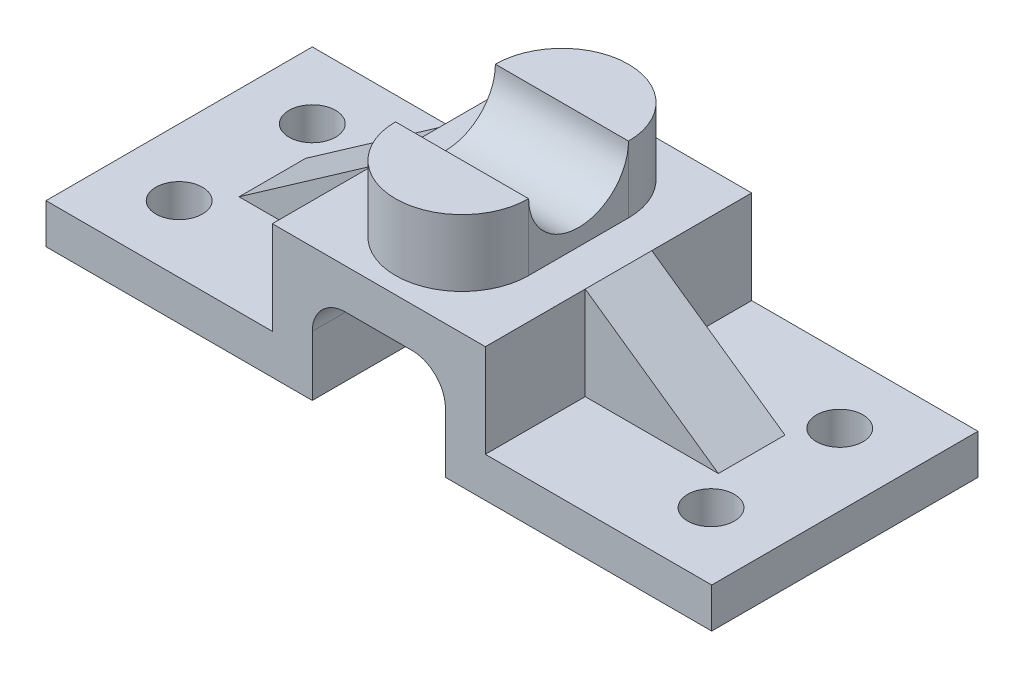
from build123d import *

# Parameters (mm, degrees)
SKETCH1_W           = 100
SKETCH1_H           = 40
SKETCH1_R           = 3.5
BOSS_EXTRUDE1_DEPTH = 6
SKETCH2_W           = 32
SKETCH2_H           = 40
BOSS_EXTRUDE2_DEPTH = 14
SKETCH3_W           = 20
SKETCH3_H           = 40
CUT_EXTRUDE1_DEPTH  = 14
FILLET2_R           = 5
FILLET3_R           = 5
BOSS_EXTRUDE3_DEPTH = 10
BOSS_EXTRUDE4_DEPTH = 10
SKETCH8_R           = 7.5
CUT_EXTRUDE2_DEPTH  = 29


with BuildPart() as part:
    # Sketch1 → Boss-Extrude1 (new body)
    with BuildSketch(Plane(origin=(0, 0, 0), x_dir=(1, 0, 0), z_dir=(0, 1, 0))):
        with Locations((-26.320522258, -4.639903709)):
            Rectangle(SKETCH1_W, SKETCH1_H)
        with Locations(Location((-66.320522258, 5.360096291, 0), (0, 0, 270))):
            Circle(SKETCH1_R, mode=Mode.SUBTRACT)
        with Locations(Location((-66.320522258, -14.639903709, 0), (0, 0, 270))):
            Circle(SKETCH1_R, mode=Mode.SUBTRACT)
        with Locations(Location((12.912927844, 5.360096291, 0), (0, 0, 270))):
            Circle(SKETCH1_R, mode=Mode.SUBTRACT)
        with Locations(Location((13.573914865, -14.639903709, 0), (0, 0, 270))):
            Circle(SKETCH1_R, mode=Mode.SUBTRACT)
    extrude(amount=BOSS_EXTRUDE1_DEPTH)

    # Sketch2 → Boss-Extrude2 (add)
    with BuildSketch(Plane(origin=(0, 6, 0), x_dir=(1, 0, 0), z_dir=(0, 1, 0))):
        with Locations((-26.320522258, -4.639903709)):
            Rectangle(SKETCH2_W, SKETCH2_H)
    extrude(amount=BOSS_EXTRUDE2_DEPTH)

    # Sketch3 → Cut-Extrude1 (cut)
    with BuildSketch(Plane.XZ):
        with Locations((-26.320522258, 4.639903709)):
            Rectangle(SKETCH3_W, SKETCH3_H)
    extrude(amount=-CUT_EXTRUDE1_DEPTH, mode=Mode.SUBTRACT)

    # Fillet2
    fillet2_edges = [part.edges().sort_by_distance(p)[0] for p in [
        (-36.320522258, 14, 4.639903709),
    ]]
    fillet(fillet2_edges, radius=FILLET2_R)

    # Fillet3
    fillet3_edges = [part.edges().sort_by_distance(p)[0] for p in [
        (-16.320522258, 14, 4.639903709),
    ]]
    fillet(fillet3_edges, radius=FILLET3_R)

    # Sketch6 → Boss-Extrude3 (add)
    with BuildSketch(Plane.XY.offset(9.639903709)):
        Polygon((-10.320522258, 6), (9.679477742, 6), (-10.320522258, 20), align=None)
        Polygon((-42.320522258, 6), (-62.320522258, 6), (-42.320522258, 20), align=None)
    extrude(amount=-BOSS_EXTRUDE3_DEPTH)

    # Sketch7 → Boss-Extrude4 (add)
    with BuildSketch(Plane(origin=(0, 20, 0), x_dir=(1, 0, 0), z_dir=(0, 1, 0))):
        with BuildLine():
            Line((-16.320522258, 2.860096291), (-16.320522258, -12.139903709))
            ThreePointArc((-16.320522258, -12.139903709), (-26.320522258, -22.139903709), (-36.320522258, -12.139903709))
            Line((-36.320522258, -12.139903709), (-36.320522258, 2.860096291))
            ThreePointArc((-36.320522258, 2.860096291), (-26.320522258, 12.860096291), (-16.320522258, 2.860096291))
        make_face()
    extrude(amount=BOSS_EXTRUDE4_DEPTH)

    # Sketch8 → Cut-Extrude2 (cut)
    with BuildSketch(Plane(origin=(-16.320522258, 0, 0), x_dir=(0, 0, -1), z_dir=(1, 0, 0))):
        with Locations((-4.639903709, 30)):
            Circle(SKETCH8_R)
    extrude(amount=-CUT_EXTRUDE2_DEPTH, mode=Mode.SUBTRACT)


solid = part.part
